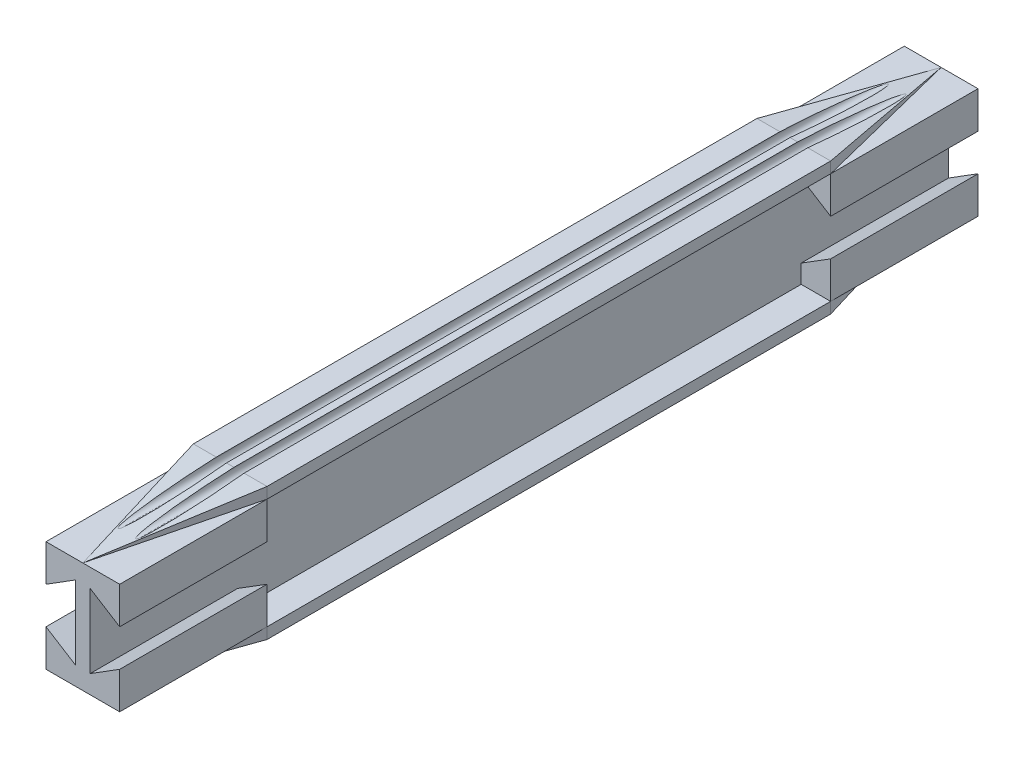
from build123d import *

# Parameters (mm, degrees)
SKETCH1_W               = 116.5
SKETCH1_H               = 15
BOSS_EXTRUDE1_DEPTH     = 1
SKETCH2_W               = 20
SKETCH2_H               = 15
BOSS_EXTRUDE2_DEPTH     = 4
CUT_EXTRUDE1_DEPTH      = 97.920070161
MIRROR2_COPY_1_SKETCH_W = 20
MIRROR2_COPY_1_SKETCH_H = 15
MIRROR2_COPY_1_DEPTH    = 4
MIRROR2_COPY_2_DEPTH    = 97.920070161
BOSS_EXTRUDE5_DEPTH     = 1.5
CUT_EXTRUDE2_DEPTH      = 60.783463433
SKETCH9_R               = 0.75
CUT_EXTRUDE3_DEPTH      = 117.954050806


with BuildPart() as part:
    # Sketch1 → Boss-Extrude1 (new, symmetric)
    with BuildSketch(Plane(origin=(0, 0, 0), x_dir=(0, 0, -1), z_dir=(1, 0, 0))):
        Rectangle(SKETCH1_W, SKETCH1_H)
    extrude(amount=BOSS_EXTRUDE1_DEPTH, both=True)

    # Sketch2 → Boss-Extrude2 (add)
    with BuildSketch(Plane(origin=(1, 0, 0), x_dir=(0, 0, -1), z_dir=(1, 0, 0))):
        with Locations((48.25, 0)):
            Rectangle(SKETCH2_W, SKETCH2_H)
    boss_extrude2 = extrude(amount=BOSS_EXTRUDE2_DEPTH)

    # Sketch3 → Cut-Extrude1 (cut, through all)
    with BuildSketch(Plane.XY.offset(-38.25)):
        Polygon((5, 2.5), (1, 5), (1, -5), (5, -2.5), align=None)
    cut_extrude1 = extrude(amount=-CUT_EXTRUDE1_DEPTH, mode=Mode.SUBTRACT)

    # Mirror1: Boss-Extrude2, Cut-Extrude1 across plane
    add(boss_extrude2.mirror(Plane(origin=(0, 0, 0), x_dir=(0, 0, 1), z_dir=(1, 0, 0))))
    add(cut_extrude1.mirror(Plane(origin=(0, 0, 0), x_dir=(0, 0, 1), z_dir=(1, 0, 0))), mode=Mode.SUBTRACT)

    # Mirror2: Boss-Extrude2, Cut-Extrude1 across plane
    add(boss_extrude2.mirror(Plane.XY))
    add(cut_extrude1.mirror(Plane.XY), mode=Mode.SUBTRACT)

    # Mirror2 copy 1 sketch → Mirror2 copy 1 (add)
    with BuildSketch(Plane.ZY.offset(1)):
        with Locations((48.25, 0)):
            Rectangle(MIRROR2_COPY_1_SKETCH_W, MIRROR2_COPY_1_SKETCH_H)
    extrude(amount=MIRROR2_COPY_1_DEPTH)

    # Mirror2 copy 2 sketch → Mirror2 copy 2 (cut, through all)
    with BuildSketch(Plane(origin=(0, 0, 38.25), x_dir=(-1, 0, 0), z_dir=(0, 0, -1))):
        Polygon((5, 2.5), (1, 5), (1, -5), (5, -2.5), align=None)
    extrude(amount=-MIRROR2_COPY_2_DEPTH, mode=Mode.SUBTRACT)

    # Sketch7 → Boss-Extrude5 (add)
    with BuildSketch(Plane(origin=(0, 7.5, 0), x_dir=(1, 0, 0), z_dir=(0, 1, 0))):
        Polygon((0, -58.25), (-5, -38.25), (-5, 38.25), (0, 58.25), (5, 38.25), (5, -38.25), align=None)
    boss_extrude5 = extrude(amount=BOSS_EXTRUDE5_DEPTH)

    # Sketch8 → Cut-Extrude2 (cut, through all)
    with BuildSketch(Plane.ZY.offset(5)):
        Polygon((-38.25, 9), (-58.25, 7.5), (-58.25, 9), align=None)
        Polygon((58.25, 9), (38.25, 9), (58.25, 7.5), align=None)
    cut_extrude2 = extrude(amount=-CUT_EXTRUDE2_DEPTH, mode=Mode.SUBTRACT)

    # Sketch9 → Cut-Extrude3 (cut, through all)
    with BuildSketch(Plane.XY.offset(58.25)):
        with Locations((1.2, 8.7)):
            Circle(SKETCH9_R)
        with Locations((-1.2, 8.7)):
            Circle(SKETCH9_R)
    cut_extrude3 = extrude(amount=-CUT_EXTRUDE3_DEPTH, mode=Mode.SUBTRACT)

    # Mirror4: Boss-Extrude5, Cut-Extrude2, Cut-Extrude3 across plane
    add(boss_extrude5.mirror(Plane.ZX))
    add(cut_extrude2.mirror(Plane.ZX), mode=Mode.SUBTRACT)
    add(cut_extrude3.mirror(Plane.ZX), mode=Mode.SUBTRACT)


solid = part.part
